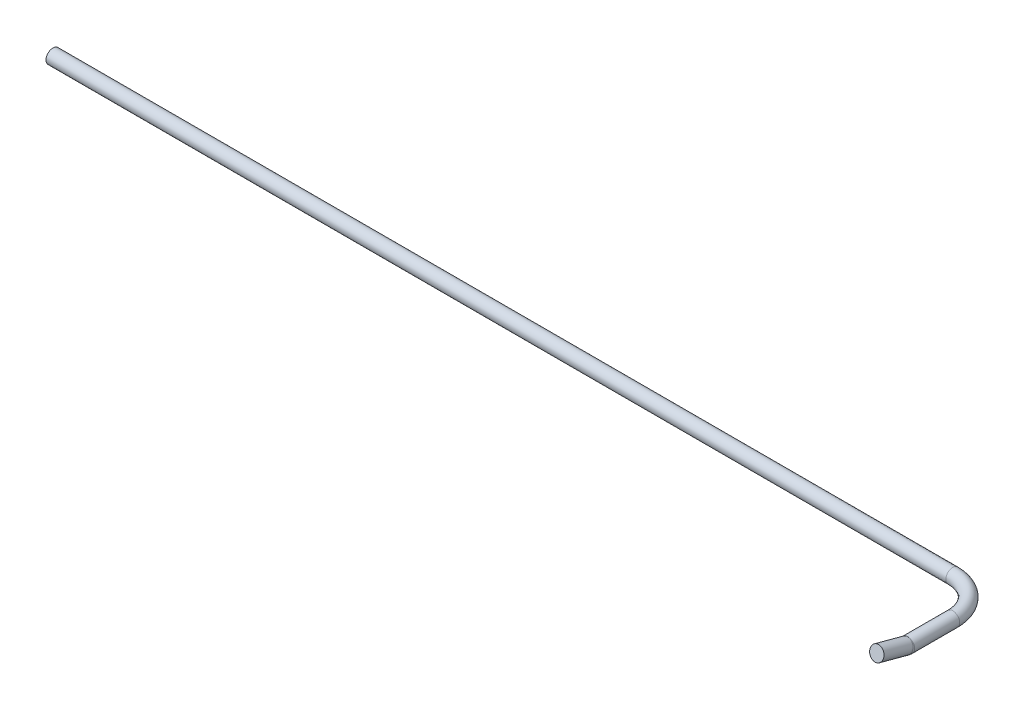
from build123d import *

# Parameters (mm, degrees)
SKETCH1_R           = 1.1811
RODEND_DEPTH        = 7.62
SKETCH4_R           = 1.1811
REVOLVE1_ANGLE      = 90
SKETCH5_R           = 1.1811
BOSS_EXTRUDE1_DEPTH = 152.4
SKETCH6_R           = 1.1811
REVOLVE2_ANGLE      = 15
SKETCH7_R           = 1.1811
BOSS_EXTRUDE2_DEPTH = 5.08


with BuildPart() as part:
    # Sketch1 → RodEnd (new body)
    with BuildSketch(Plane.XY):
        Circle(SKETCH1_R)
    extrude(amount=-RODEND_DEPTH)

    # Sketch4 → Revolve1 (revolve)
    with BuildSketch(Plane(origin=(0, 0, -7.62), x_dir=(-1, 0, 0), z_dir=(0, 0, -1))):
        with Locations(Location((0, 0, 0), (0, 0, 180))):
            Circle(SKETCH4_R)
    revolve(axis=Axis((-6.35, 0, -7.62), (0, 1, 0)), revolution_arc=REVOLVE1_ANGLE)

    # Sketch5 → Boss-Extrude1 (add)
    with BuildSketch(Plane.ZY.offset(6.35)):
        with Locations(Location((-13.97, 0, 0), (0, 0, 180))):
            Circle(SKETCH5_R)
    extrude(amount=BOSS_EXTRUDE1_DEPTH)

    # Sketch6 → Revolve2 (revolve)
    with BuildSketch(Plane.XY):
        Circle(SKETCH6_R)
    revolve(axis=Axis((0, 1.27, 0), (-1, 0, 0)), revolution_arc=REVOLVE2_ANGLE)

    # Sketch7 → Boss-Extrude2 (add)
    with BuildSketch(Plane(origin=(0, 0.085073869, 0.3175), x_dir=(1, 0, 0), z_dir=(0, 0.2588190451025214, 0.9659258262890682))):
        with Locations(Location((0, -0.043274201, 0), (0, 0, 270))):
            Circle(SKETCH7_R)
    extrude(amount=BOSS_EXTRUDE2_DEPTH)


solid = part.part
